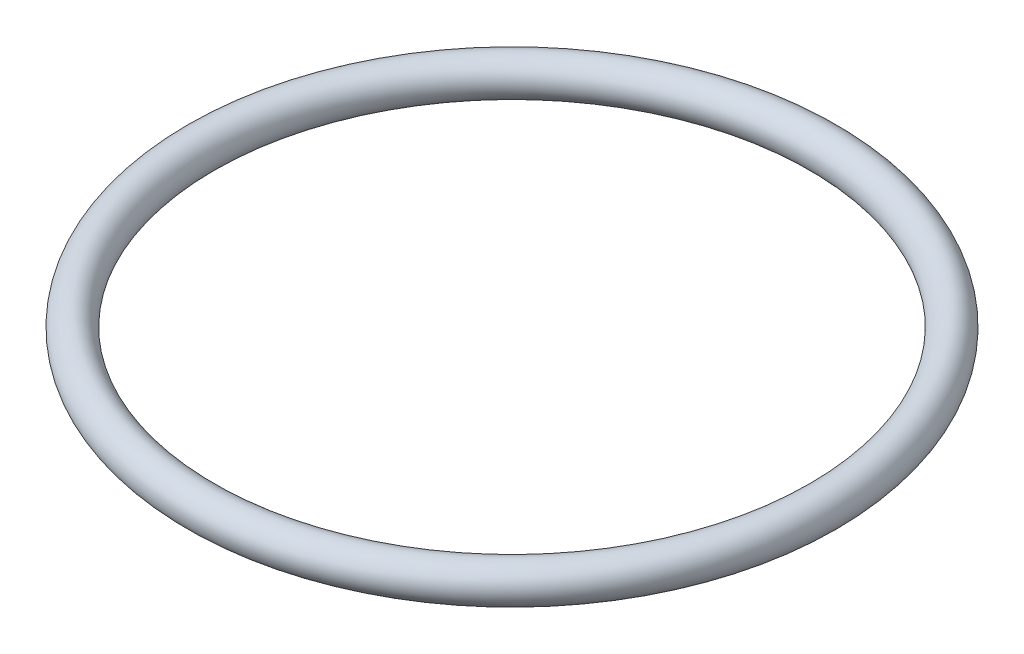
from build123d import *

# Parameters (mm, degrees)
ESBO_O3_R = 3.175


with BuildPart() as part:
    # Varredura1: sweep along a path in Esboço1
    with BuildLine(Plane(origin=(0, 0, 0), x_dir=(1, 0, 0), z_dir=(0, 1, 0))) as varredura1_path:
        CenterArc((0, 0), 52.9375, 0, 360)
    # Esboço3 → Varredura1 (sweep)
    with BuildSketch(Plane.XY):
        with Locations((-52.9375, 0)):
            Circle(ESBO_O3_R)
    sweep(path=varredura1_path.line)


solid = part.part
